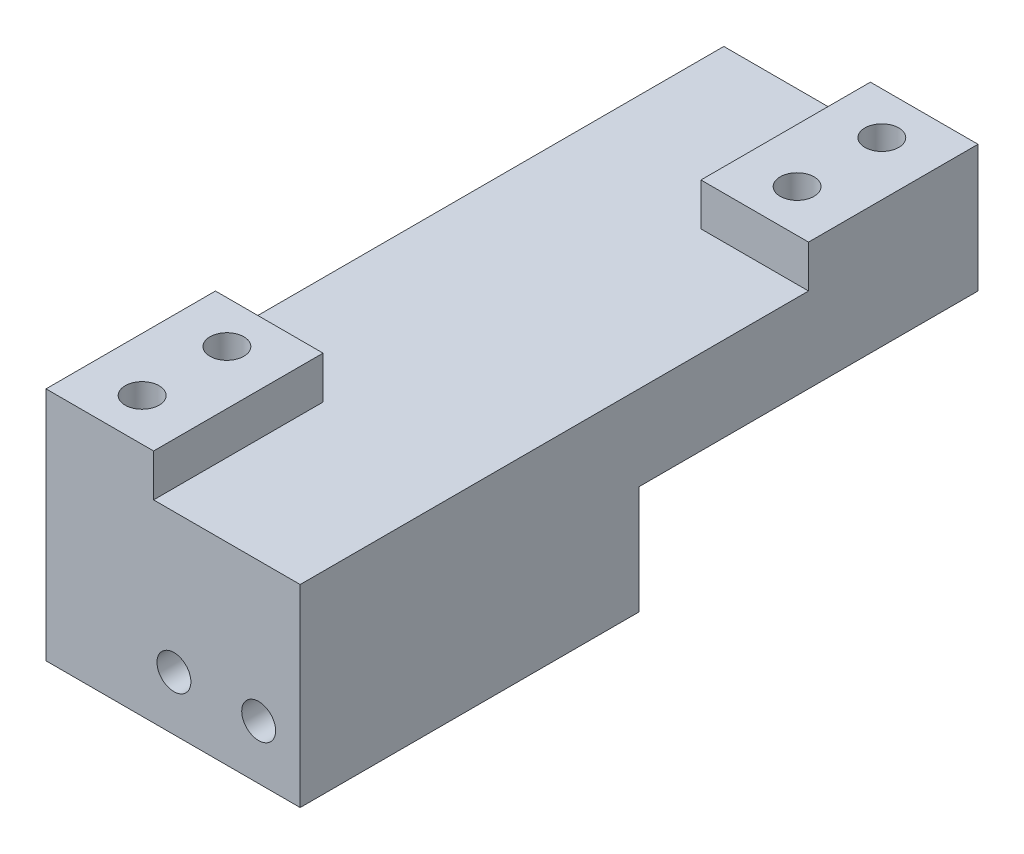
from build123d import *

# Parameters (mm, degrees)
SKETCH1_W           = 30
SKETCH1_H           = 80
BOSS_EXTRUDE1_DEPTH = 30
SKETCH2_W           = 12.7
SKETCH2_H           = 20
SKETCH2_R           = 2
BOSS_EXTRUDE2_DEPTH = 5
SKETCH3_R           = 2
CUT_EXTRUDE1_DEPTH  = 93.330926563
SKETCH4_W           = 20
SKETCH4_H           = 20
CUT_EXTRUDE2_DEPTH  = 40
SKETCH5_R           = 2
SKETCH5_W           = 30
SKETCH5_H           = 7.2
CUT_EXTRUDE3_DEPTH  = 93.330926563


with BuildPart() as part:
    # Sketch1 → Boss-Extrude1 (new body)
    with BuildSketch(Plane(origin=(0, 0, 0), x_dir=(1, 0, 0), z_dir=(0, 1, 0))):
        with Locations((-15, 40)):
            Rectangle(SKETCH1_W, SKETCH1_H)
    extrude(amount=BOSS_EXTRUDE1_DEPTH)

    # Sketch2 → Boss-Extrude2 (add)
    # profile 1 of 2: a face of its own
    with BuildSketch(Plane(origin=(0, 30, 0), x_dir=(1, 0, 0), z_dir=(0, 1, 0))):
        with Locations((-23.65, 10)):
            Rectangle(SKETCH2_W, SKETCH2_H)
        with Locations(Location((-23.65, 5, 0), (0, 0, 270))):
            Circle(SKETCH2_R, mode=Mode.SUBTRACT)
        with Locations(Location((-23.65, 15, 0), (0, 0, 270))):
            Circle(SKETCH2_R, mode=Mode.SUBTRACT)
    # profile 2 of 2: a face of its own
    with BuildSketch(Plane(origin=(0, 30, 0), x_dir=(1, 0, 0), z_dir=(0, 1, 0))):
        with Locations((-6.35, 70)):
            Rectangle(SKETCH2_W, SKETCH2_H)
        with Locations(Location((-6.35, 65, 0), (0, 0, 270))):
            Circle(SKETCH2_R, mode=Mode.SUBTRACT)
        with Locations(Location((-6.35, 75, 0), (0, 0, 270))):
            Circle(SKETCH2_R, mode=Mode.SUBTRACT)
    extrude(amount=BOSS_EXTRUDE2_DEPTH)

    # Sketch3 → Cut-Extrude1 (cut, through all)
    with BuildSketch(Plane(origin=(0, 35, 0), x_dir=(1, 0, 0), z_dir=(0, 1, 0))):
        with Locations(Location((-23.65, 15, 0), (0, 0, 270))):
            Circle(SKETCH3_R)
        with Locations(Location((-23.65, 5, 0), (0, 0, 270))):
            Circle(SKETCH3_R)
        with Locations(Location((-6.35, 75, 0), (0, 0, 270))):
            Circle(SKETCH3_R)
        with Locations(Location((-6.35, 65, 0), (0, 0, 270))):
            Circle(SKETCH3_R)
    extrude(amount=-CUT_EXTRUDE1_DEPTH, mode=Mode.SUBTRACT)

    # Sketch4 → Cut-Extrude2 (cut)
    with BuildSketch(Plane(origin=(0, 0, -80), x_dir=(-1, 0, 0), z_dir=(0, 0, -1))):
        with Locations((10, 10)):
            Rectangle(SKETCH4_W, SKETCH4_H)
    extrude(amount=-CUT_EXTRUDE2_DEPTH, mode=Mode.SUBTRACT)

    # Sketch5 → Cut-Extrude3 (cut, through all)
    with BuildSketch(Plane(origin=(0, 0, -80), x_dir=(-1, 0, 0), z_dir=(0, 0, -1))):
        with Locations((4.9, 13.6)):
            Circle(SKETCH5_R)
        with Locations((14.9, 13.6)):
            Circle(SKETCH5_R)
        with Locations((15, 3.6)):
            Rectangle(SKETCH5_W, SKETCH5_H)
    extrude(amount=-CUT_EXTRUDE3_DEPTH, mode=Mode.SUBTRACT)


solid = part.part
